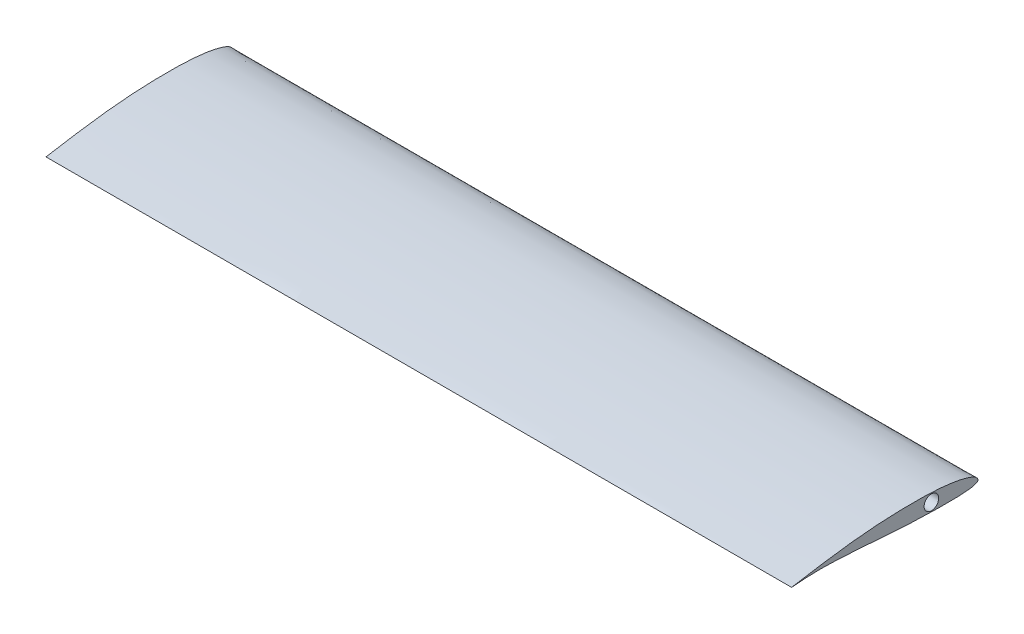
from build123d import *

# Parameters (mm, degrees)
SCHIZZO1_R                   = 9
ESTRUSIONE_ESTRUSIONE1_DEPTH = 920


with BuildPart() as part:
    # Schizzo1 → Estrusione-Estrusione1 (new body)
    with BuildSketch(Plane(origin=(0, 0, 0), x_dir=(0, 0, -1), z_dir=(1, 0, 0))):
        with BuildLine():
            add(Edge.make_bspline(
                [(-230, 0), (-230.00021003, -0.007399372), (-228.422159074, 0.158585605), (-226.796663426, 0.283994814), (-222.814236356, 0.630838106), (-217.861944362, 0.988173407), (-211.305955076, 1.377531861), (-203.489426002, 1.677361114), (-194.430608751, 1.810216013), (-184.341493445, 1.686563372), (-173.419920533, 1.278436867), (-161.877392424, 0.649532952), (-149.896910924, -0.14739195), (-137.646510004, -1.056175021), (-125.282246595, -2.015650917), (-112.945769304, -2.962017261), (-100.7584493, -3.820523677), (-88.822408297, -4.543479216), (-77.225553758, -5.093884246), (-66.057692147, -5.471836348), (-55.425635523, -5.720974864), (-45.446834259, -5.846940175), (-36.245448099, -5.870876926), (-27.932980055, -5.763845292), (-20.619206615, -5.531191724), (-14.376129052, -5.149639189), (-9.26615491, -4.534410053), (-5.241877203, -3.717211223), (-2.415294988, -2.636492746), (-0.455293487, -1.574606192), (0.019607545, -0.377617892), (-0.028675664, 0.729247041), (-0.747591303, 2.12122959), (-2.510554435, 3.899284231), (-5.308314662, 5.628718351), (-9.09046738, 7.280506666), (-13.86893603, 8.870012724), (-19.594852044, 10.381184769), (-26.217398351, 11.765311218), (-33.678783534, 12.970008115), (-41.927186165, 13.946674696), (-50.906277269, 14.684031678), (-60.551213579, 15.174544159), (-70.77686616, 15.448630529), (-81.481593106, 15.5155738), (-92.549239895, 15.388578068), (-103.857719904, 15.072714259), (-115.286686554, 14.559527773), (-126.724287809, 13.84814532), (-138.066593632, 12.934591948), (-149.216065051, 11.851060027), (-160.069948376, 10.625337918), (-170.524175291, 9.306949751), (-180.470035162, 7.941788795), (-189.79640609, 6.560992773), (-198.31552254, 5.272724027), (-206.058984479, 3.949831517), (-212.854340269, 2.927264164), (-218.726725632, 1.931027024), (-223.212303817, 1.146192963), (-226.912966986, 0.508635751), (-228.462126565, 0.226519423), (-229.999791678, 0.007339187), (-230, 0)],
                knots=[0, 0, 0, 0, 0.001588889, 0.006329218, 0.014202456, 0.025172808, 0.039173483, 0.056060631, 0.075578924, 0.097363607, 0.120926258, 0.145825281, 0.171670912, 0.198108537, 0.224790184, 0.25139058, 0.277643491, 0.30332675, 0.328257458, 0.352272548, 0.375156062, 0.396620664, 0.416422729, 0.43430442, 0.45005468, 0.463465465, 0.474478994, 0.483169222, 0.489678354, 0.494104066, 0.496910015, 0.497289785, 0.501214273, 0.50645795, 0.513356957, 0.522168632, 0.53296597, 0.545689209, 0.560220779, 0.576438923, 0.594258689, 0.613600245, 0.634342386, 0.656331109, 0.679351894, 0.703152303, 0.727478208, 0.752070739, 0.776691164, 0.801140184, 0.825214387, 0.848697424, 0.871352858, 0.892947449, 0.913230871, 0.931955467, 0.948342069, 0.963693004, 0.976235918, 0.986320059, 0.993788799, 0.998424035, 1, 1, 1, 1], degree=3))
        make_face()
        with Locations((-57.5, 4.671139351)):
            Circle(SCHIZZO1_R, mode=Mode.SUBTRACT)
    extrude(amount=ESTRUSIONE_ESTRUSIONE1_DEPTH)


solid = part.part
